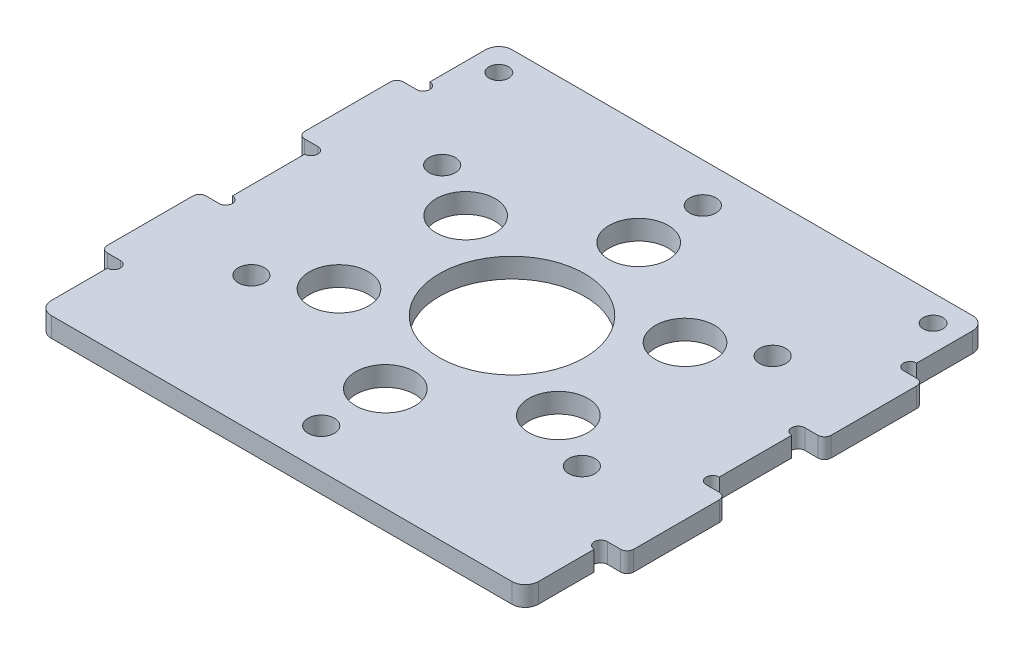
from build123d import *

# Parameters (mm, degrees)
SKETCH_2_R          = 11.05
SKETCH_2_R_2        = 2
SKETCH_2_R_3        = 4.5
SKETCH_2_R_4        = 1.5
EXTRUDE_1_DEPTH     = 3
SKETCH_3_R          = 1
CUT_EXTRUDE_1_DEPTH = 54.235326617
FILLET_1_R          = 1
FILLET_2_R          = 2


with BuildPart() as part:
    # 草图2 → 凸台-拉伸1 (new body)
    with BuildSketch(Plane(origin=(0, 0, 0), x_dir=(1, 0, 0), z_dir=(0, 1, 0))):
        Polygon((-37, 35), (37, 35), (37, 22.5), (40, 22.5), (40, 7.5), (37, 7.5), (37, -7.5), (40, -7.5), (40, -22.5), (37, -22.5), (37, -35), (-37, -35), (-37, -22.5), (-40, -22.5), (-40, -7.5), (-37, -7.5), (-37, 7.5), (-40, 7.5), (-40, 22.5), (-37, 22.5), align=None)
        with Locations(Location((0, 0, 0), (0, 0, 270))):
            Circle(SKETCH_2_R, mode=Mode.SUBTRACT)
        with Locations(Location((0, 29, 0), (0, 0, 270))):
            Circle(SKETCH_2_R_2, mode=Mode.SUBTRACT)
        with Locations(Location((0, 19.25, 0), (0, 0, 270))):
            Circle(SKETCH_2_R_3, mode=Mode.SUBTRACT)
        with Locations(Location((-33, 31, 0), (0, 0, 270))):
            Circle(SKETCH_2_R_4, mode=Mode.SUBTRACT)
        with Locations(Location((25.11473671, 14.5, 0), (0, 0, 270))):
            Circle(SKETCH_2_R_2, mode=Mode.SUBTRACT)
        with Locations(Location((16.670989023, 9.625, 0), (0, 0, 270))):
            Circle(SKETCH_2_R_3, mode=Mode.SUBTRACT)
        with Locations(Location((25.11473671, -14.5, 0), (0, 0, 270))):
            Circle(SKETCH_2_R_2, mode=Mode.SUBTRACT)
        with Locations(Location((16.670989023, -9.625, 0), (0, 0, 270))):
            Circle(SKETCH_2_R_3, mode=Mode.SUBTRACT)
        with Locations(Location((0, -29, 0), (0, 0, 270))):
            Circle(SKETCH_2_R_2, mode=Mode.SUBTRACT)
        with Locations(Location((0, -19.25, 0), (0, 0, 270))):
            Circle(SKETCH_2_R_3, mode=Mode.SUBTRACT)
        with Locations(Location((-25.11473671, -14.5, 0), (0, 0, 270))):
            Circle(SKETCH_2_R_2, mode=Mode.SUBTRACT)
        with Locations(Location((-16.670989023, -9.625, 0), (0, 0, 270))):
            Circle(SKETCH_2_R_3, mode=Mode.SUBTRACT)
        with Locations(Location((-25.11473671, 14.5, 0), (0, 0, 270))):
            Circle(SKETCH_2_R_2, mode=Mode.SUBTRACT)
        with Locations(Location((-16.670989023, 9.625, 0), (0, 0, 270))):
            Circle(SKETCH_2_R_3, mode=Mode.SUBTRACT)
        with Locations(Location((33, 31, 0), (0, 0, 90))):
            Circle(SKETCH_2_R_4, mode=Mode.SUBTRACT)
    extrude(amount=EXTRUDE_1_DEPTH)

    # 草图3 → 切除-拉伸1 (cut, through all)
    with BuildSketch(Plane(origin=(0, 3, 0), x_dir=(1, 0, 0), z_dir=(0, 1, 0))):
        with Locations((-37, 23.5)):
            Circle(SKETCH_3_R)
        with Locations((-37, 6.5)):
            Circle(SKETCH_3_R)
        with Locations((-37, -6.5)):
            Circle(SKETCH_3_R)
        with Locations((-37, -23.5)):
            Circle(SKETCH_3_R)
        with Locations((37, -23.5)):
            Circle(SKETCH_3_R)
        with Locations((37, -6.5)):
            Circle(SKETCH_3_R)
        with Locations((37, 6.5)):
            Circle(SKETCH_3_R)
        with Locations((37, 23.5)):
            Circle(SKETCH_3_R)
    extrude(amount=-CUT_EXTRUDE_1_DEPTH, mode=Mode.SUBTRACT)

    # 圆角1
    fillet_1_edges = [part.edges().sort_by_distance(p)[0] for p in [
        (40, 1.5, -22.5),
        (40, 1.5, -7.5),
        (40, 1.5, 7.5),
        (40, 1.5, 22.5),
        (-40, 1.5, 22.5),
        (-40, 1.5, 7.5),
        (-40, 1.5, -7.5),
        (-40, 1.5, -22.5),
    ]]
    fillet(fillet_1_edges, radius=FILLET_1_R)

    # 圆角2
    fillet_2_edges = [part.edges().sort_by_distance(p)[0] for p in [
        (-37, 1.5, -35),
        (37, 1.5, -35),
        (37, 1.5, 35),
        (-37, 1.5, 35),
    ]]
    fillet(fillet_2_edges, radius=FILLET_2_R)


solid = part.part
